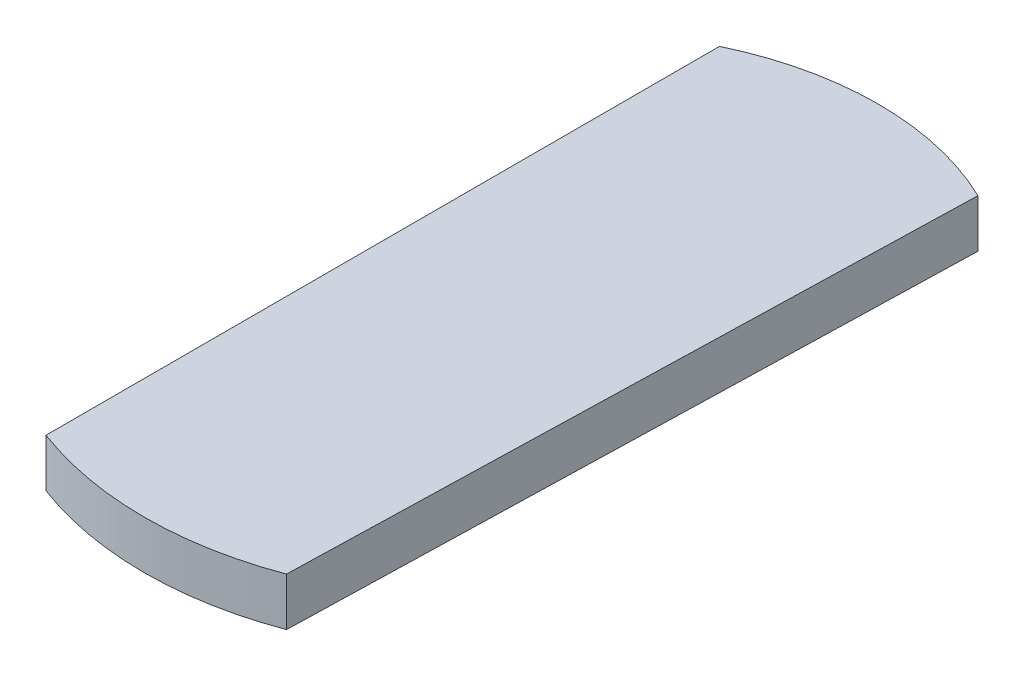
from build123d import *

# Parameters (mm, degrees)
BOSS_EXTRUDE2_DEPTH = 8


with BuildPart() as part:
    # Sketch1 → Boss-Extrude2 (new body)
    with BuildSketch(Plane(origin=(0, 0, 0), x_dir=(1, 0, 0), z_dir=(0, 1, 0))):
        with BuildLine():
            Line((-9.220338983, 62.779661017), (-9.220338983, -49.220338983))
            ThreePointArc((-9.220338983, -49.220338983), (10.779661017, -52.855422504), (30.779661017, -49.220338983))
            Line((30.779661017, -49.220338983), (33.779661017, 62.779661017))
            ThreePointArc((33.779661017, 62.779661017), (12.279661017, 67.681848201), (-9.220338983, 62.779661017))
        make_face()
    extrude(amount=BOSS_EXTRUDE2_DEPTH)


solid = part.part
